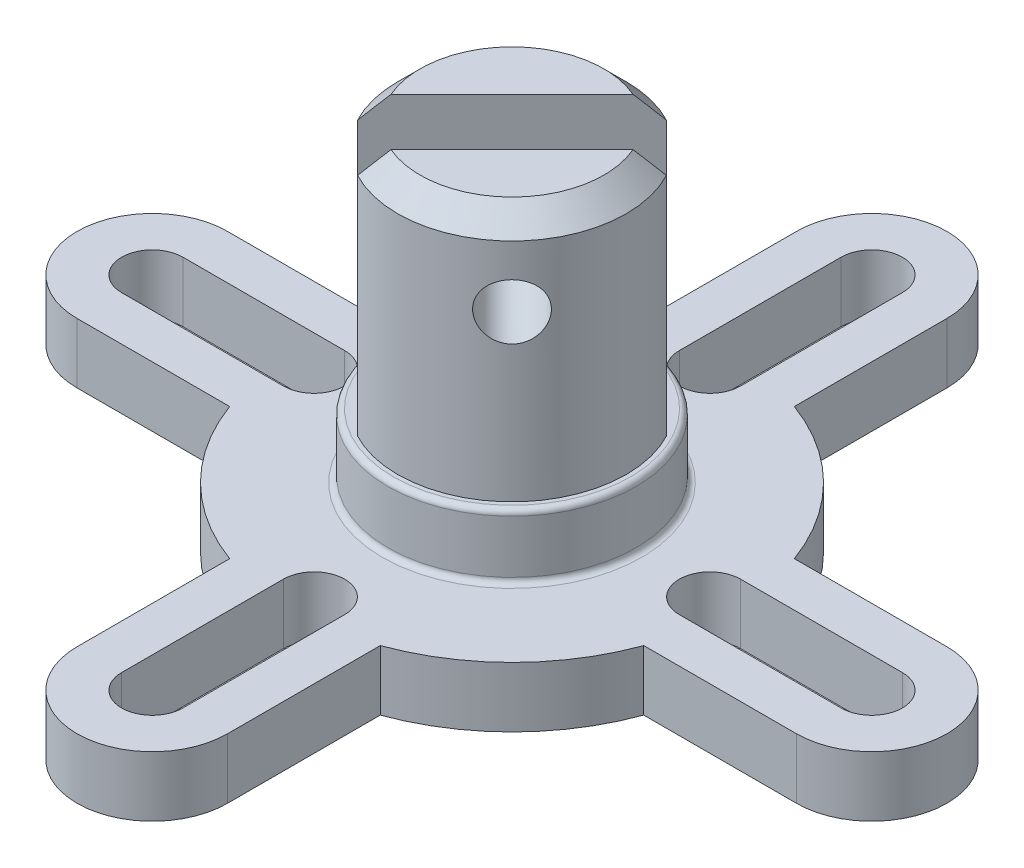
from build123d import *

# Parameters (mm, degrees)
SKETCH3_R                      = 10.033
BOSS_EXTRUDE1_DEPTH            = 2.7432
BOSS_EXTRUDE2_START            = -2.7432
BOSS_EXTRUDE2_DEPTH            = 2.7432
CUT_EXTRUDE1_REACH             = 24.376
CIRPATTERN1_COUNT              = 4
SKETCH5_R                      = 5.6515
BOSS_EXTRUDE3_DEPTH            = 2.921
BOSS_EXTRUDE4_DEPTH            = 11.303
CHAMFER1_SIZE                  = 1.016
FILLET1_R                      = 0.254
CUT_EXTRUDE2_REACH             = 36.085
SKETCH7_R                      = 1.27
CUT_EXTRUDE2_DIRECTION_2_REACH = 36.085


with BuildPart() as part:
    # Sketch3 → Boss-Extrude1 (new body)
    with BuildSketch(Plane(origin=(0, 0, 0), x_dir=(1, 0, 0), z_dir=(0, 1, 0))):
        with Locations(Location((0, 0, 0), (0, 0, 270))):
            Circle(SKETCH3_R)
    extrude(amount=BOSS_EXTRUDE1_DEPTH)

    # Sketch4 → Boss-Extrude2 (add)
    with BuildSketch(Plane(origin=(0, 2.7432, 0), x_dir=(1, 0, 0), z_dir=(0, 1, 0)).offset(BOSS_EXTRUDE2_START)):
        with BuildLine():
            ThreePointArc((9.428841286, 3.429), (9.73521463, 2.426249185), (9.935264466, 1.397))
            Line((9.935264466, 1.397), (16.383, 1.397))
            ThreePointArc((16.383, 1.397), (17.78, 0), (16.383, -1.397))
            Line((16.383, -1.397), (9.935264466, -1.397))
            ThreePointArc((9.935264466, -1.397), (9.73521463, -2.426249185), (9.428841286, -3.429))
            Line((9.428841286, -3.429), (16.383, -3.429))
            ThreePointArc((16.383, -3.429), (19.812, 0), (16.383, 3.429))
            Line((16.383, 3.429), (9.428841286, 3.429))
        make_face()
    boss_extrude2 = extrude(amount=BOSS_EXTRUDE2_DEPTH)

    # Sketch4<3> → Cut-Extrude1 (cut, up to next)
    with BuildSketch(Plane(origin=(0, 2.7432, 0), x_dir=(1, 0, 0), z_dir=(0, 1, 0)), mode=Mode.PRIVATE) as cut_extrude1_sk1:
        with BuildLine():
            Line((9.935264466, 1.397), (9.017, 1.397))
            ThreePointArc((9.017, 1.397), (7.62, 0), (9.017, -1.397))
            Line((9.017, -1.397), (9.935264466, -1.397))
            ThreePointArc((9.935264466, -1.397), (10.008536291, -0.700207333), (10.033, 0))
            ThreePointArc((10.033, 0), (10.008536291, 0.700207333), (9.935264466, 1.397))
        make_face()
    cut_extrude1_tool1 = extrude(cut_extrude1_sk1.sketch, amount=-CUT_EXTRUDE1_REACH, mode=Mode.PRIVATE) & part.part
    cut_extrude1 = cut_extrude1_tool1.solids().sort_by_distance((8.936983, 2.7432, 0))[0]
    add(cut_extrude1, mode=Mode.SUBTRACT)

    # CirPattern1: Boss-Extrude2, Cut-Extrude1 ×4 about axis
    cirpattern1_axis = Axis((0, 0, 0), (0, 1, 0))
    add([boss_extrude2.rotate(cirpattern1_axis, i * 360 / CIRPATTERN1_COUNT) for i in range(1, CIRPATTERN1_COUNT)])
    add([cut_extrude1.rotate(cirpattern1_axis, i * 360 / CIRPATTERN1_COUNT) for i in range(1, CIRPATTERN1_COUNT)], mode=Mode.SUBTRACT)

    # Sketch5 → Boss-Extrude3 (add)
    with BuildSketch(Plane(origin=(0, 2.7432, 0), x_dir=(1, 0, 0), z_dir=(0, 1, 0))):
        with Locations(Location((0, 0, 0), (0, 0, 270))):
            Circle(SKETCH5_R)
    extrude(amount=BOSS_EXTRUDE3_DEPTH)

    # Sketch6 → Boss-Extrude4 (add)
    with BuildSketch(Plane(origin=(0, 5.6642, 0), x_dir=(1, 0, 0), z_dir=(0, 1, 0))):
        with BuildLine():
            ThreePointArc((5.207, 0), (5.054935189, 1.249191434), (4.607622532, 2.425420294))
            Line((4.607622532, 2.425420294), (-2.425420294, -4.607622532))
            ThreePointArc((-2.425420294, -4.607622532), (2.691067216, -4.457690684), (5.207, 0))
        make_face()
        with BuildLine():
            Line((-4.607622532, -2.425420294), (2.425420294, 4.607622532))
            ThreePointArc((2.425420294, 4.607622532), (-3.68190501, 3.68190501), (-4.607622532, -2.425420294))
        make_face()
    extrude(amount=BOSS_EXTRUDE4_DEPTH)

    # Chamfer1
    chamfer1_edges = [part.edges().sort_by_distance(p)[0] for p in [
        (3.68190501, 16.9672, 3.68190501),
        (-3.68190501, 16.9672, -3.68190501),
    ]]
    chamfer(chamfer1_edges, length=CHAMFER1_SIZE)

    # Fillet1
    fillet1_edges = [part.edges().sort_by_distance(p)[0] for p in [
        (0, 2.7432, -5.6515),
        (0, 5.6642, -5.6515),
    ]]
    fillet(fillet1_edges, radius=FILLET1_R)

    # Sketch7 → Cut-Extrude2 (cut, up to next)
    with BuildSketch(Plane(origin=(-1.091101119, 0, -1.091101119), x_dir=(0.7071067811865486, 0, -0.7071067811865465), z_dir=(0.7071067811865465, 0, 0.7071067811865486)), mode=Mode.PRIVATE) as cut_extrude2_sk1:
        with Locations(Location((0, 13.1572, 0), (0, 0, 180))):
            Circle(SKETCH7_R)
    cut_extrude2_tool1 = extrude(cut_extrude2_sk1.sketch, amount=-CUT_EXTRUDE2_REACH, mode=Mode.PRIVATE) & part.part
    add(cut_extrude2_tool1.solids().sort_by_distance((-1.091101, 13.1572, -1.091101))[0], mode=Mode.SUBTRACT)

    # Sketch7 → Cut-Extrude2 direction 2 (cut, up to next)
    with BuildSketch(Plane(origin=(-1.091101119, 0, -1.091101119), x_dir=(0.7071067811865486, 0, -0.7071067811865465), z_dir=(0.7071067811865465, 0, 0.7071067811865486)), mode=Mode.PRIVATE) as cut_extrude2_direction_2_sk1:
        with Locations(Location((0, 13.1572, 0), (0, 0, 180))):
            Circle(SKETCH7_R)
    cut_extrude2_direction_2_tool1 = extrude(cut_extrude2_direction_2_sk1.sketch, amount=CUT_EXTRUDE2_DIRECTION_2_REACH, mode=Mode.PRIVATE) & part.part
    add(cut_extrude2_direction_2_tool1.solids().sort_by_distance((-1.091101, 13.1572, -1.091101))[0], mode=Mode.SUBTRACT)


solid = part.part
